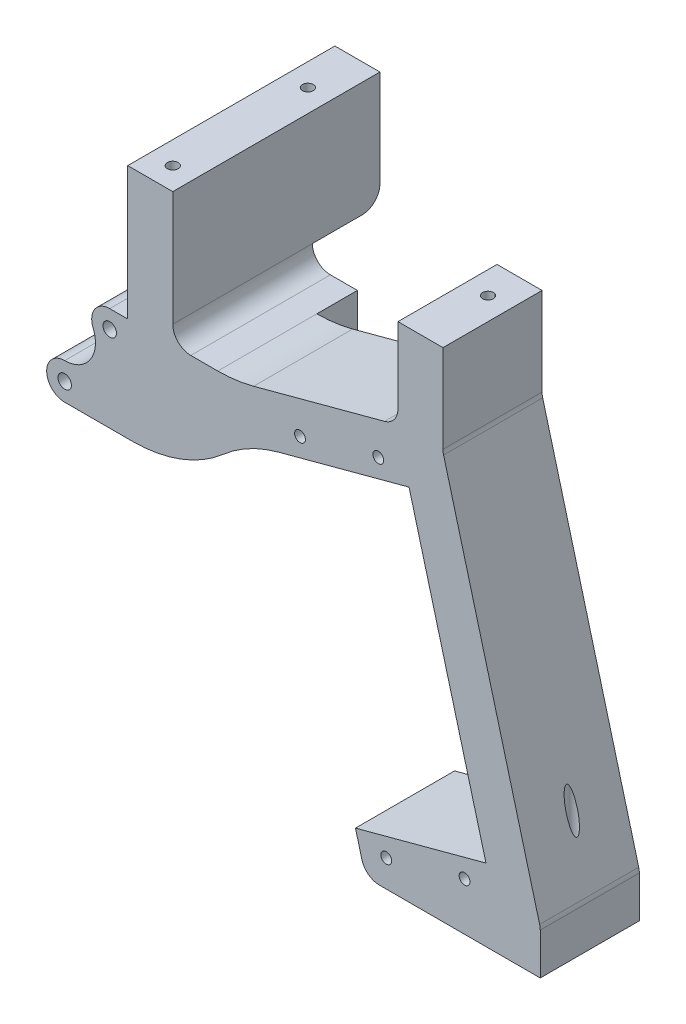
from build123d import *

# Parameters (mm, degrees)
ESQUISSE1_R             = 1.5
BOSS_EXTRU_1_DEPTH      = 20
ESQUISSE2_W             = 19
ESQUISSE2_H             = 8
ESQUISSE2_R             = 1.2
BOSS_EXTRU_2_DEPTH      = 31
ESQUISSE3_R             = 1.2
BOSS_EXTRU_3_DEPTH      = 22
BOSS_EXTRU_4_DEPTH      = 29.5
BOSS_EXTRU_4_DEPTH_BACK = 1.5
ESQUISSE4_W             = 10
ESQUISSE4_H             = 46
ESQUISSE4_R             = 1.2
ESQUISSE5_W             = 10
ESQUISSE5_H             = 22
ESQUISSE5_R             = 1.2
BOSS_EXTRU_5_DEPTH      = 25
ENL_V_MAT_EXTRU_2_REACH = 133.043
CONG_1_R                = 4
ESQUISSE6_R             = 1.2
ENL_V_MAT_EXTRU_1_DEPTH = 149.35162727
ESQUISSE8_R             = 1.2
ENL_V_MAT_EXTRU_3_DEPTH = 9


with BuildPart() as part:
    # Esquisse1 → Boss.-Extru.1 (new, symmetric)
    with BuildSketch(Plane.XY):
        with BuildLine():
            Line((5, 4), (5, -19))
            Line((5, -19), (-10, -19))
            ThreePointArc((-10, -19), (-14, -15), (-10, -11))
            ThreePointArc((-10, -11), (-4.314322989, -7.957118008), (-3.692307692, -1.538461538))
            ThreePointArc((-3.692307692, -1.538461538), (-3.328201177, 2.218800785), (0, 4))
            Line((0, 4), (5, 4))
        make_face()
        Circle(ESQUISSE1_R, mode=Mode.SUBTRACT)
        with Locations((-10, -15)):
            Circle(ESQUISSE1_R, mode=Mode.SUBTRACT)
    extrude(amount=BOSS_EXTRU_1_DEPTH, both=True)

    # Esquisse2 → Boss.-Extru.2 (add)
    with BuildSketch(Plane.XY.offset(20)):
        with Locations((14.5, 0)):
            Rectangle(ESQUISSE2_W, ESQUISSE2_H)
        with Locations((10, -1)):
            Circle(ESQUISSE2_R, mode=Mode.SUBTRACT)
        with Locations((20, -1)):
            Circle(ESQUISSE2_R, mode=Mode.SUBTRACT)
    extrude(amount=-BOSS_EXTRU_2_DEPTH)

    # Esquisse3 → Boss.-Extru.3 (add)
    with BuildSketch(Plane.XY.offset(20)):
        with BuildLine():
            Line((5, -19), (5, 4))
            Line((5, 4), (24, 4))
            ThreePointArc((24, 4), (28.008865219, 4.262754908), (31.949137643, 5.046523824))
            Line((31.949137643, 5.046523824), (73.277207334, 16.120346723))
            Line((73.277207334, 16.120346723), (95.6, -67.189449674))
            Line((95.6, -67.189449674), (95.6, -76.921217678))
            Line((95.6, -76.921217678), (56.796572161, -76.921217678))
            Line((56.796572161, -76.921217678), (54.569702951, -68.610428644))
            Line((54.569702951, -68.610428644), (83.54747774, -60.84585729))
            Line((83.54747774, -60.84585729), (66.465420763, 2.905247245))
            Line((66.465420763, 2.905247245), (37.487645974, -4.859324108))
            ThreePointArc((37.487645974, -4.859324108), (30.977583086, -7.429293495), (25.218391809, -11.406400142))
            ThreePointArc((25.218391809, -11.406400142), (15.798681935, -17.038995869), (5, -19))
        make_face()
        with Locations((42.247924752, 0.557293467)):
            Circle(ESQUISSE3_R, mode=Mode.SUBTRACT)
        with Locations(Location((59.634589625, 5.216036279, 0), (0, 0, 180))):
            Circle(ESQUISSE3_R, mode=Mode.SUBTRACT)
        with Locations(Location((61.400534089, -70.921217678, 0), (0, 0, 180))):
            Circle(ESQUISSE3_R, mode=Mode.SUBTRACT)
        with Locations((78.787198962, -66.262474866)):
            Circle(ESQUISSE3_R, mode=Mode.SUBTRACT)
    extrude(amount=-BOSS_EXTRU_3_DEPTH)

    # Esquisse4 → Boss.-Extru.4 (add, two sides: drawn at the far end of the back side and taken through both)
    with BuildSketch(Plane(origin=(0, 4, 0), x_dir=(1, 0, 0), z_dir=(0, 1, 0)).offset(-BOSS_EXTRU_4_DEPTH_BACK)):
        with Locations((9, 3)):
            Rectangle(ESQUISSE4_W, ESQUISSE4_H)
        with Locations(Location((9, 15, 0), (0, 0, 90))):
            Circle(ESQUISSE4_R, mode=Mode.SUBTRACT)
        with Locations(Location((9, -15, 0), (0, 0, 270))):
            Circle(ESQUISSE4_R, mode=Mode.SUBTRACT)
    extrude(amount=BOSS_EXTRU_4_DEPTH + BOSS_EXTRU_4_DEPTH_BACK)

    # Esquisse5 → Boss.-Extru.5 (add)
    with BuildSketch(Plane(origin=(0, 33.5, 0), x_dir=(1, 0, 0), z_dir=(0, 1, 0))):
        with Locations((69, -9)):
            Rectangle(ESQUISSE5_W, ESQUISSE5_H)
        with Locations(Location((69, -5, 0), (0, 0, 270))):
            Circle(ESQUISSE5_R, mode=Mode.SUBTRACT)
    extrude(amount=-BOSS_EXTRU_5_DEPTH)

    # Enlèv. mat.-Extru.2: up to this face of the body (flat: up to its plane)
    enl_v_mat_extru_2_end = Plane(part.part.faces().sort_by_distance((14.986481498, -0.269035286, -11))[0])
    # Esquisse7 → Enlèv. mat.-Extru.2 (cut, up to the picked face)
    with BuildSketch(Plane(origin=(0, 0, -26), x_dir=(-1, 0, 0), z_dir=(0, 0, -1)), mode=Mode.PRIVATE) as enl_v_mat_extru_2_sk1:
        with BuildLine():
            Line((-14, 2.5), (-14, 8))
            Line((-14, 8), (-4, 8))
            Line((-4, 8), (0, 4))
            ThreePointArc((0, 4), (-3.535533906, 2.535533906), (-5, -1))
            Line((-5, -1), (-14, 2.5))
        make_face()
    enl_v_mat_extru_2_tool1 = split(extrude(enl_v_mat_extru_2_sk1.sketch, amount=-ENL_V_MAT_EXTRU_2_REACH, mode=Mode.PRIVATE), bisect_by=enl_v_mat_extru_2_end, keep=Keep.BOTH, mode=Mode.PRIVATE)
    add(enl_v_mat_extru_2_tool1.solids().sort_by(Axis((7.945486, 4.393993, -26), (0, 0, 1)))[0], mode=Mode.SUBTRACT)

    # Congé1
    cong_1_edges = [part.edges().sort_by_distance(p)[0] for p in [
        (14, 4, 4.5),
        (74, 13.42284777, 9),
        (64, 13.63452651, 9),
        (56.796572161, -76.921217678, 9),
        (95.6, -67.189449674, 9),
        (9, 8, -26),
    ]]
    fillet(cong_1_edges, radius=CONG_1_R)

    # Esquisse6 → Enlèv. mat.-Extru.1 (cut, through all)
    with BuildSketch(Plane.XZ.offset(76.921217678)):
        with Locations(Location((91.6, 9, 0), (0, 0, 270))):
            Circle(ESQUISSE6_R)
    extrude(amount=-ENL_V_MAT_EXTRU_1_DEPTH, mode=Mode.SUBTRACT)

    # Esquisse8 → Enlèv. mat.-Extru.3 (cut)
    with BuildSketch(Plane(origin=(0, 0, -26), x_dir=(-1, 0, 0), z_dir=(0, 0, -1))):
        with Locations((-7, 26.5)):
            Circle(ESQUISSE8_R)
        with Locations((-7, 17.5)):
            Circle(ESQUISSE8_R)
    extrude(amount=-ENL_V_MAT_EXTRU_3_DEPTH, mode=Mode.SUBTRACT)


solid = part.part
